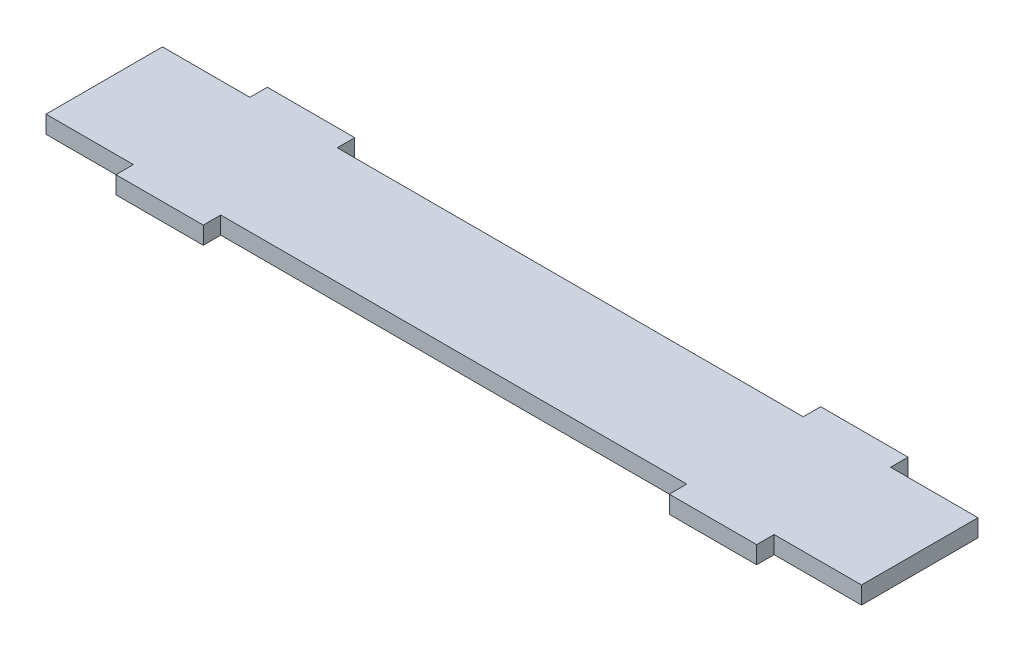
from build123d import *

# Parameters (mm, degrees)
SKETCH_1_W      = 140
SKETCH_1_H      = 20
SKETCH_1_W_2    = 15
SKETCH_1_H_2    = 3
EXTRUDE_1_DEPTH = 3


with BuildPart() as part:
    # 草图1 → 凸台-拉伸1 (new body)
    with BuildSketch(Plane(origin=(0, 0, 0), x_dir=(1, 0, 0), z_dir=(0, 1, 0))):
        Rectangle(SKETCH_1_W, SKETCH_1_H)
        with Locations((-47.5, 11.5)):
            Rectangle(SKETCH_1_W_2, SKETCH_1_H_2)
        with Locations((-47.5, -11.5)):
            Rectangle(SKETCH_1_W_2, SKETCH_1_H_2)
        with Locations((47.5, 11.5)):
            Rectangle(SKETCH_1_W_2, SKETCH_1_H_2)
        with Locations((47.5, -11.5)):
            Rectangle(SKETCH_1_W_2, SKETCH_1_H_2)
    extrude(amount=EXTRUDE_1_DEPTH)


solid = part.part
